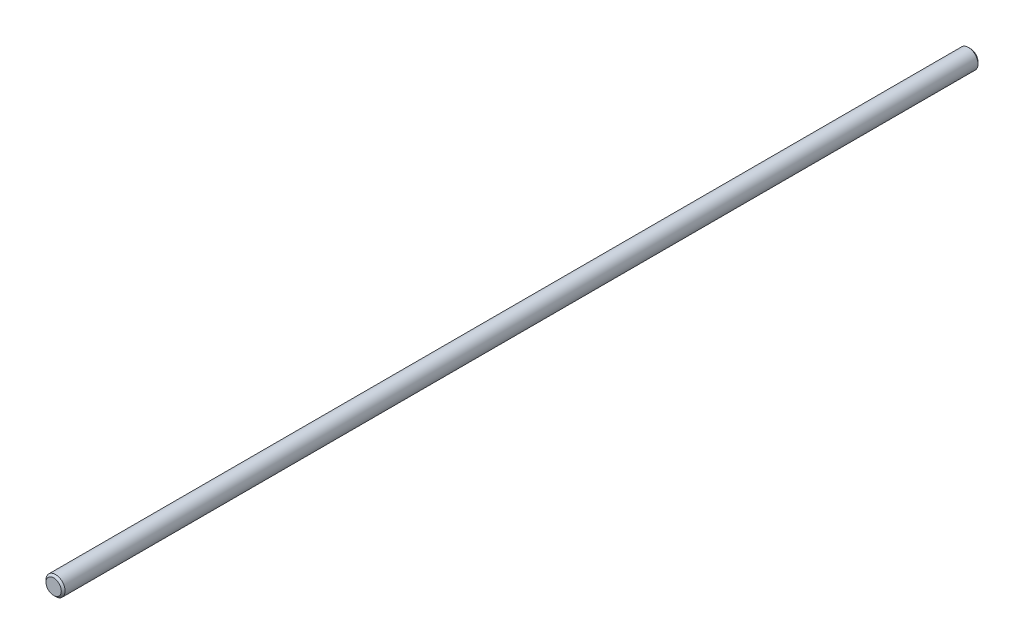
from build123d import *

# Parameters (mm, degrees)
SKETCH3_R           = 2.38125
BOSS_EXTRUDE1_DEPTH = 114.3
CHAMFER1_SIZE       = 0.47625


with BuildPart() as part:
    # Sketch3 → Boss-Extrude1 (new, symmetric)
    with BuildSketch(Plane.XY):
        Circle(SKETCH3_R)
    extrude(amount=BOSS_EXTRUDE1_DEPTH, both=True)

    # Chamfer1
    chamfer1_edges = [part.edges().sort_by_distance(p)[0] for p in [
        (-2.38125, 0, -114.3),
        (-2.38125, 0, 114.3),
    ]]
    chamfer(chamfer1_edges, length=CHAMFER1_SIZE)


solid = part.part
